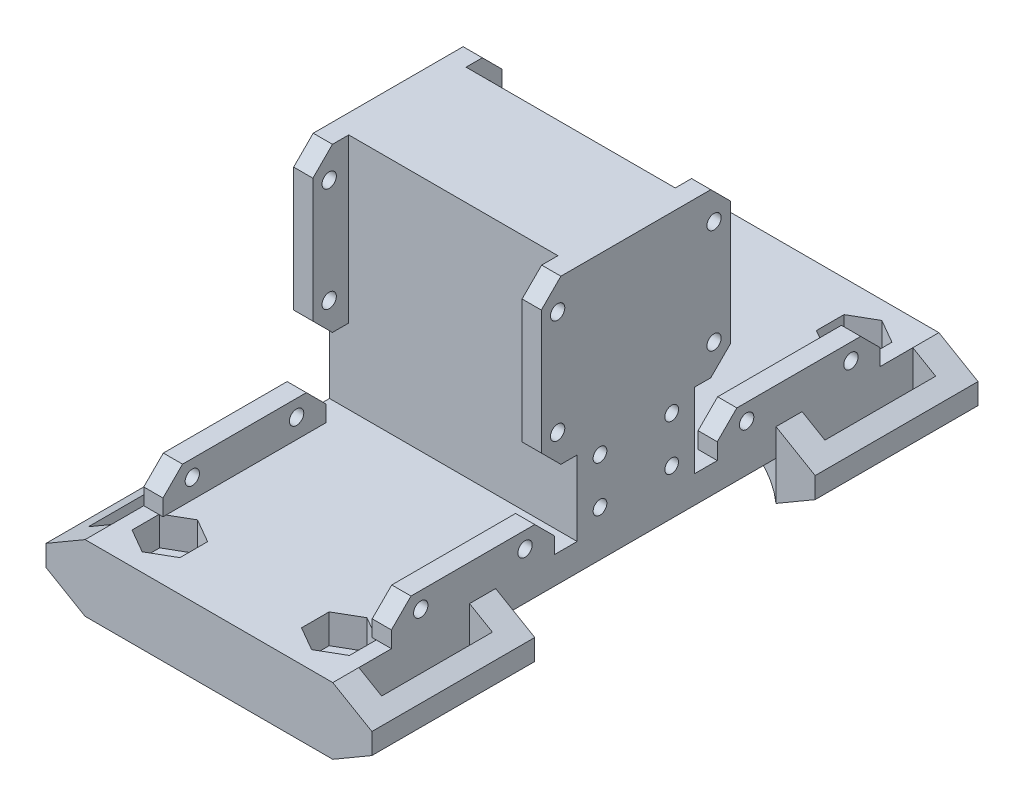
from build123d import *

# Parameters (mm, degrees)
SKETCH1_W                       = 38
SKETCH1_H                       = 10.2
MAIN_BASE_DEPTH                 = 46.5
SKETCH2_R                       = 28.7
FREE_SPACE_DEPTH                = 6
BRACKETS1_START                 = 21.51023
BRACKETS1_DEPTH                 = 24.98977
BRACKETS2_START                 = -46.5
BRACKETS2_DEPTH                 = 24.98977
BRACKET_HOLES_DEPTH             = 54.040173454
BRACKET_HOLES_DEPTH_BACK        = 54.040173454
SKETCH5_W                       = 3.5
SKETCH5_H                       = 16.989769876
BOLT_HOLES_DEPTH                = 54.040173454
BOLT_HOLES_DEPTH_BACK           = 54.040173454
SKETCH6_R                       = 2.25
NUT_START                       = 5.1
NUT_SLOTS_DEPTH                 = 4.5
SKETCH8_W                       = 38
SKETCH8_H                       = 18
MOTOR_BASE_DEPTH                = 36.5
MOTOR_START                     = 19
SKETCH9_R                       = 1.1
MOTOR_BRACKETS1_DEPTH           = 2.95
MOTOR_START_2                   = -16.05
SKETCH9_2_R                     = 1.1
MOTOR_BRACKETS2_DEPTH           = 2.95
SKETCH10_R                      = 1.05
MOTOR_DRIVER_MOUNT_HOLES1_DEPTH = 10


with BuildPart() as part:
    # Sketch1 → Main_base (new, symmetric)
    with BuildSketch(Plane.XY):
        Rectangle(SKETCH1_W, SKETCH1_H)
    extrude(amount=MAIN_BASE_DEPTH, both=True)

    # Sketch2 → Free space (cut)
    with BuildSketch(Plane.XZ.offset(5.1)):
        Circle(SKETCH2_R)
    extrude(amount=-FREE_SPACE_DEPTH, mode=Mode.SUBTRACT)

    # Sketch3 → Brackets1 (add)
    with BuildSketch(Plane.XY.offset(BRACKETS1_START)):
        Polygon((25, 1.6), (25, -1.6), (19, -5.1), (19, 5.1), align=None)
        Polygon((-25, 1.6), (-19, 5.1), (-19, -5.1), (-25, -1.6), align=None)
    extrude(amount=BRACKETS1_DEPTH)

    # Sketch3<2> → Brackets2 (add)
    with BuildSketch(Plane.XY.offset(BRACKETS2_START)):
        Polygon((25, 1.6), (25, -1.6), (19, -5.1), (19, 5.1), align=None)
        Polygon((-25, 1.6), (-19, 5.1), (-19, -5.1), (-25, -1.6), align=None)
    extrude(amount=BRACKETS2_DEPTH)

    # Sketch5 → Bracket holes (cut, two sides: drawn at the far end of the back side and taken through both)
    with BuildSketch(Plane(origin=(0, 0, 0), x_dir=(1, 0, 0), z_dir=(0, 1, 0)).offset(-BRACKET_HOLES_DEPTH_BACK)):
        with Locations((20.75, -34.005115062)):
            Rectangle(SKETCH5_W, SKETCH5_H)
        with Locations((-20.75, -34.005115062)):
            Rectangle(SKETCH5_W, SKETCH5_H)
        with Locations((-20.75, 34.005115062)):
            Rectangle(SKETCH5_W, SKETCH5_H)
        with Locations((20.75, 34.005115062)):
            Rectangle(SKETCH5_W, SKETCH5_H)
    extrude(amount=BRACKET_HOLES_DEPTH + BRACKET_HOLES_DEPTH_BACK, mode=Mode.SUBTRACT)

    # Sketch6 → Bolt holes (cut, two sides: drawn at the far end of the back side and taken through both)
    with BuildSketch(Plane(origin=(0, 0, 0), x_dir=(1, 0, 0), z_dir=(0, 1, 0)).offset(-BOLT_HOLES_DEPTH_BACK)):
        with Locations(Location((-13, 39.5, 0), (0, 0, 270))):
            Circle(SKETCH6_R)
        with Locations(Location((-13, -39.5, 0), (0, 0, 270))):
            Circle(SKETCH6_R)
        with Locations(Location((13, -39.5, 0), (0, 0, 270))):
            Circle(SKETCH6_R)
        with Locations(Location((13, 39.5, 0), (0, 0, 270))):
            Circle(SKETCH6_R)
    extrude(amount=BOLT_HOLES_DEPTH + BOLT_HOLES_DEPTH_BACK, mode=Mode.SUBTRACT)

    # Sketch7 → Nut slots (cut)
    with BuildSketch(Plane(origin=(0, 0, 0), x_dir=(1, 0, 0), z_dir=(0, 1, 0)).offset(NUT_START)):
        Polygon((13, 35.256475), (16.675000452, 37.3782375), (16.675000452, 41.6217625), (13, 43.743525), (9.324999548, 41.6217625), (9.324999548, 37.3782375), align=None)
        Polygon((-9.324999548, 37.3782375), (-13, 35.256475), (-16.675000452, 37.3782375), (-16.675000452, 41.6217625), (-13, 43.743525), (-9.324999548, 41.6217625), align=None)
        Polygon((-13, -35.256475), (-16.675000452, -37.3782375), (-16.675000452, -41.6217625), (-13, -43.743525), (-9.324999548, -41.6217625), (-9.324999548, -37.3782375), align=None)
        Polygon((9.324999548, -37.3782375), (13, -35.256475), (16.675000452, -37.3782375), (16.675000452, -41.6217625), (13, -43.743525), (9.324999548, -41.6217625), align=None)
    extrude(amount=-NUT_SLOTS_DEPTH, mode=Mode.SUBTRACT)

    # Sketch8 → Motor base (add)
    with BuildSketch(Plane(origin=(0, 5.1, 0), x_dir=(1, 0, 0), z_dir=(0, 1, 0))):
        Rectangle(SKETCH8_W, SKETCH8_H)
    extrude(amount=MOTOR_BASE_DEPTH)

    # Sketch9 → Motor brackets1 (add)
    # profile 1 of 4: a face of its own
    with BuildSketch(Plane(origin=(0, 0, 0), x_dir=(0, 0, -1), z_dir=(1, 0, 0)).offset(MOTOR_START)):
        Polygon((-9, 41.6), (-11.5, 41.6), (-14.5, 38.6), (-14.5, 19.6), (-11.5, 16.6), (-9, 16.6), align=None)
        with Locations((-12, 21.1)):
            Circle(SKETCH9_R, mode=Mode.SUBTRACT)
        with Locations((-12, 37.1)):
            Circle(SKETCH9_R, mode=Mode.SUBTRACT)
    # profile 2 of 4: a face of its own
    with BuildSketch(Plane(origin=(0, 0, 0), x_dir=(0, 0, -1), z_dir=(1, 0, 0)).offset(MOTOR_START)):
        Polygon((-37.5, 5.1), (-12.5, 5.1), (-12.5, 7.6), (-15.5, 10.6), (-34.5, 10.6), (-37.5, 7.6), align=None)
        with Locations((-33, 8.1)):
            Circle(SKETCH9_R, mode=Mode.SUBTRACT)
        with Locations((-17, 8.1)):
            Circle(SKETCH9_R, mode=Mode.SUBTRACT)
    # profile 3 of 4: a face of its own
    with BuildSketch(Plane(origin=(0, 0, 0), x_dir=(0, 0, -1), z_dir=(1, 0, 0)).offset(MOTOR_START)):
        Polygon((11.5, 41.6), (14.5, 38.6), (14.5, 19.6), (11.5, 16.6), (9, 16.6), (9, 41.6), align=None)
        with Locations((12, 37.1)):
            Circle(SKETCH9_R, mode=Mode.SUBTRACT)
        with Locations((12, 21.1)):
            Circle(SKETCH9_R, mode=Mode.SUBTRACT)
    # profile 4 of 4: a face of its own
    with BuildSketch(Plane(origin=(0, 0, 0), x_dir=(0, 0, -1), z_dir=(1, 0, 0)).offset(MOTOR_START)):
        Polygon((15.5, 10.6), (12.5, 7.6), (12.5, 5.1), (37.5, 5.1), (37.5, 7.6), (34.5, 10.6), align=None)
        with Locations((17, 8.1)):
            Circle(SKETCH9_R, mode=Mode.SUBTRACT)
        with Locations((33, 8.1)):
            Circle(SKETCH9_R, mode=Mode.SUBTRACT)
    extrude(amount=-MOTOR_BRACKETS1_DEPTH)

    # Sketch9<2> → Motor brackets2 (add)
    # profile 1 of 4: a face of its own
    with BuildSketch(Plane(origin=(0, 0, 0), x_dir=(0, 0, -1), z_dir=(1, 0, 0)).offset(MOTOR_START_2)):
        Polygon((-9, 41.6), (-11.5, 41.6), (-14.5, 38.6), (-14.5, 19.6), (-11.5, 16.6), (-9, 16.6), align=None)
        with Locations((-12, 21.1)):
            Circle(SKETCH9_2_R, mode=Mode.SUBTRACT)
        with Locations((-12, 37.1)):
            Circle(SKETCH9_2_R, mode=Mode.SUBTRACT)
    # profile 2 of 4: a face of its own
    with BuildSketch(Plane(origin=(0, 0, 0), x_dir=(0, 0, -1), z_dir=(1, 0, 0)).offset(MOTOR_START_2)):
        Polygon((-37.5, 5.1), (-12.5, 5.1), (-12.5, 7.6), (-15.5, 10.6), (-34.5, 10.6), (-37.5, 7.6), align=None)
        with Locations((-33, 8.1)):
            Circle(SKETCH9_2_R, mode=Mode.SUBTRACT)
        with Locations((-17, 8.1)):
            Circle(SKETCH9_2_R, mode=Mode.SUBTRACT)
    # profile 3 of 4: a face of its own
    with BuildSketch(Plane(origin=(0, 0, 0), x_dir=(0, 0, -1), z_dir=(1, 0, 0)).offset(MOTOR_START_2)):
        Polygon((11.5, 41.6), (14.5, 38.6), (14.5, 19.6), (11.5, 16.6), (9, 16.6), (9, 41.6), align=None)
        with Locations((12, 37.1)):
            Circle(SKETCH9_2_R, mode=Mode.SUBTRACT)
        with Locations((12, 21.1)):
            Circle(SKETCH9_2_R, mode=Mode.SUBTRACT)
    # profile 4 of 4: a face of its own
    with BuildSketch(Plane(origin=(0, 0, 0), x_dir=(0, 0, -1), z_dir=(1, 0, 0)).offset(MOTOR_START_2)):
        Polygon((15.5, 10.6), (12.5, 7.6), (12.5, 5.1), (37.5, 5.1), (37.5, 7.6), (34.5, 10.6), align=None)
        with Locations((17, 8.1)):
            Circle(SKETCH9_2_R, mode=Mode.SUBTRACT)
        with Locations((33, 8.1)):
            Circle(SKETCH9_2_R, mode=Mode.SUBTRACT)
    extrude(amount=-MOTOR_BRACKETS2_DEPTH)

    # Sketch10 → motor_driver_mount_holes1 (cut)
    with BuildSketch(Plane.ZY.offset(19)):
        with Locations((-5.5, 14.9)):
            Circle(SKETCH10_R)
        with Locations((-5.5, 7.9)):
            Circle(SKETCH10_R)
        with Locations(Location((5.5, 7.9, 0), (0, 0, 180))):
            Circle(SKETCH10_R)
        with Locations(Location((5.5, 14.9, 0), (0, 0, 180))):
            Circle(SKETCH10_R)
    motor_driver_mount_holes1 = extrude(amount=-MOTOR_DRIVER_MOUNT_HOLES1_DEPTH, mode=Mode.SUBTRACT)

    # motor_driver_mount_holes2: motor_driver_mount_holes1 across plane
    add(motor_driver_mount_holes1.mirror(Plane(origin=(0, 0, 0), x_dir=(0, 0, 1), z_dir=(1, 0, 0))), mode=Mode.SUBTRACT)


solid = part.part
